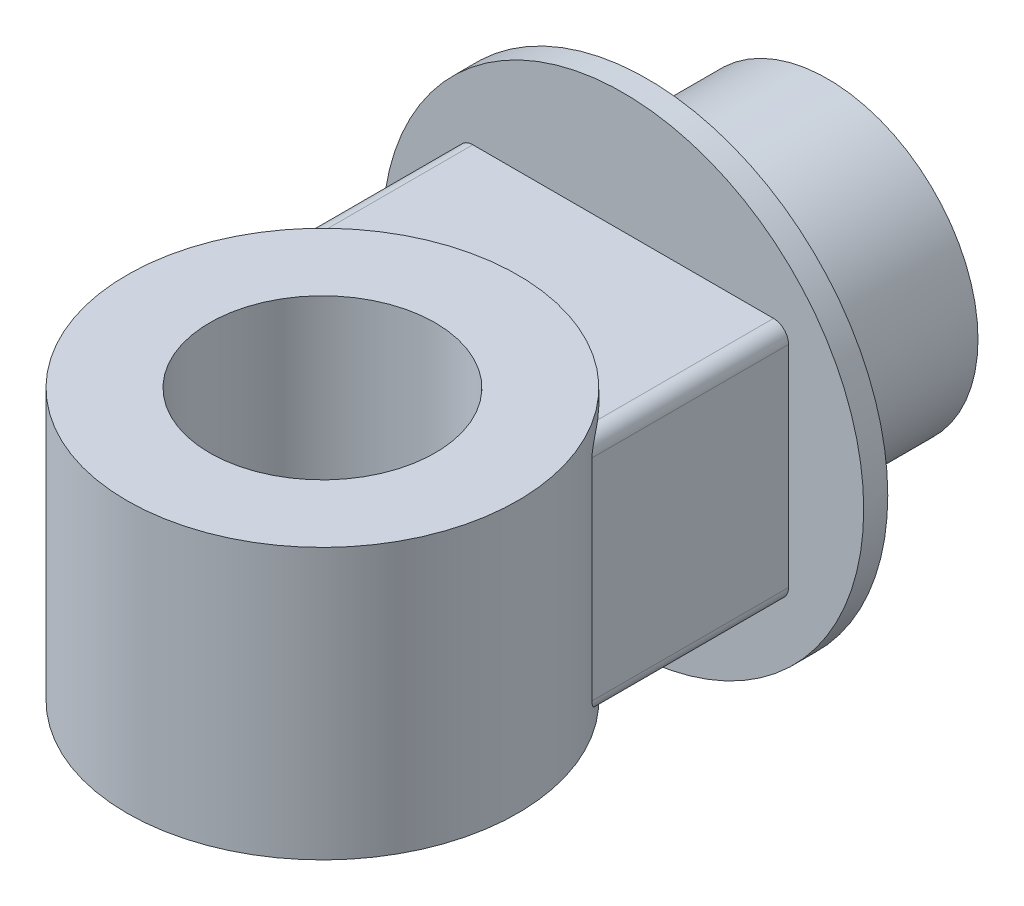
from build123d import *

# Parameters (mm, degrees)
SKETCH1_R                = 100
BOSS_EXTRUDE1_DEPTH      = 120
SKETCH2_R                = 160
BOSS_EXTRUDE2_DEPTH      = 16
SKETCH4_R                = 130
SKETCH4_R_2              = 75
BOSS_EXTRUDE3_DEPTH      = 90
BOSS_EXTRUDE4_REACH      = 402.125
BOSS_EXTRUDE4_END_RADIUS = 130
SKETCH5_W                = 220
SKETCH5_H                = 160
FILLET1_R                = 10


with BuildPart() as part:
    # Sketch1 → Boss-Extrude1 (new body)
    with BuildSketch(Plane.XY):
        Circle(SKETCH1_R)
    extrude(amount=BOSS_EXTRUDE1_DEPTH)

    # Sketch2 → Boss-Extrude2 (add)
    with BuildSketch(Plane.XY.offset(120)):
        Circle(SKETCH2_R)
    extrude(amount=BOSS_EXTRUDE2_DEPTH)



with BuildPart() as body_2:
    # Sketch4 → Boss-Extrude3 (new, symmetric)
    with BuildSketch(Plane(origin=(0, 0, 0), x_dir=(1, 0, 0), z_dir=(0, 1, 0))):
        with Locations(Location((0, -336, 0), (0, 0, 90))):
            Circle(SKETCH4_R)
        with Locations(Location((0, -336, 0), (0, 0, 90))):
            Circle(SKETCH4_R_2, mode=Mode.SUBTRACT)
    extrude(amount=BOSS_EXTRUDE3_DEPTH, both=True)


with BuildPart() as part_1:
    add(part.part)

    add(body_2.part)  # Boss-Extrude4 merges body 2
    # Boss-Extrude4: up to this cylinder (the profile starts outside it)
    boss_extrude4_end = Plane(origin=(0, 0, 336), z_dir=(0, -1, 0)) * Cylinder(BOSS_EXTRUDE4_END_RADIUS, 1065.25, mode=Mode.PRIVATE)
    # Sketch5 → Boss-Extrude4 (add, up to the surface)
    with BuildSketch(Plane.XY.offset(136), mode=Mode.PRIVATE) as boss_extrude4_sk1:
        Rectangle(SKETCH5_W, SKETCH5_H)
    boss_extrude4_tool1 = extrude(boss_extrude4_sk1.sketch, amount=BOSS_EXTRUDE4_REACH, mode=Mode.PRIVATE) - boss_extrude4_end
    add(boss_extrude4_tool1.solids().sort_by_distance((0, 0, 136))[0])

    # Fillet1
    fillet1_edges = [part_1.edges().sort_by_distance(p)[0] for p in [
        (110, 80, 201.358983849),
        (110, -80, 201.358983849),
        (-110, 80, 201.358983849),
        (-110, -80, 201.358983849),
    ]]
    fillet(fillet1_edges, radius=FILLET1_R)


solid = part_1.part
